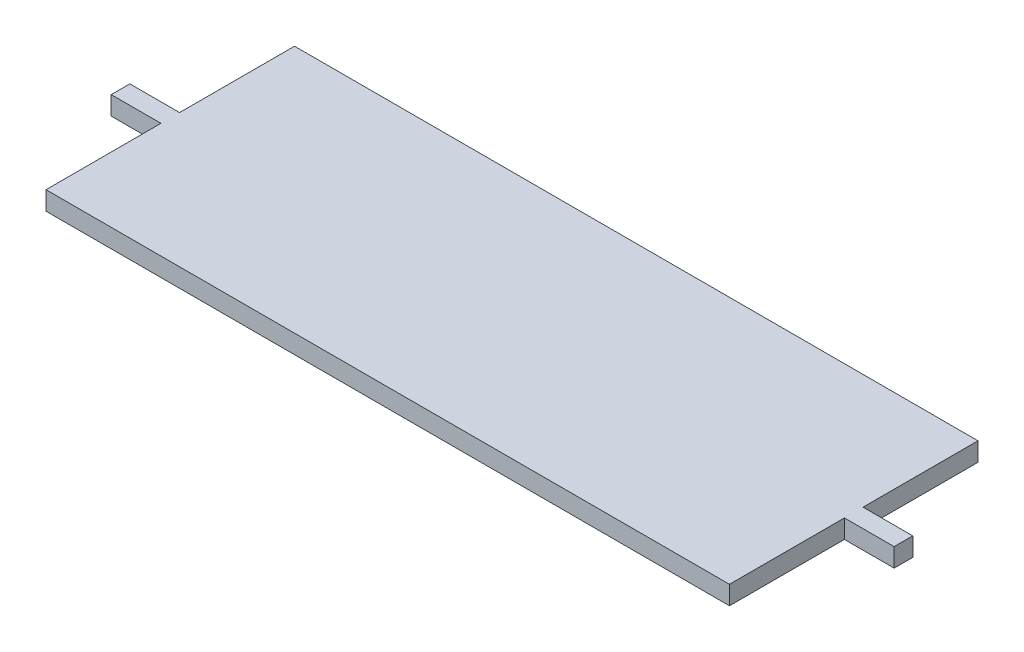
from build123d import *

# Parameters (mm, degrees)
SKETCH1_W           = 8
SKETCH1_H           = 1.5
SKETCH1_W_2         = 110
SKETCH1_H_2         = 18.5
BOSS_EXTRUDE1_DEPTH = 3


with BuildPart() as part:
    # Sketch1 → Boss-Extrude1 (new body)
    with BuildSketch(Plane(origin=(0, 0, 0), x_dir=(1, 0, 0), z_dir=(0, 1, 0))):
        with Locations((-4, 20.75)):
            Rectangle(SKETCH1_W, SKETCH1_H)
        with Locations((-4, 19.25)):
            Rectangle(SKETCH1_W, SKETCH1_H)
        Polygon((0, 20), (0, 18.5), (110, 18.5), (110, 20), (110, 21.5), (0, 21.5), align=None)
        with Locations((55, 30.75)):
            Rectangle(SKETCH1_W_2, SKETCH1_H_2)
        with Locations((55, 9.25)):
            Rectangle(SKETCH1_W_2, SKETCH1_H_2)
        with Locations((114, 20.75)):
            Rectangle(SKETCH1_W, SKETCH1_H)
        with Locations((114, 19.25)):
            Rectangle(SKETCH1_W, SKETCH1_H)
    extrude(amount=BOSS_EXTRUDE1_DEPTH)


solid = part.part
